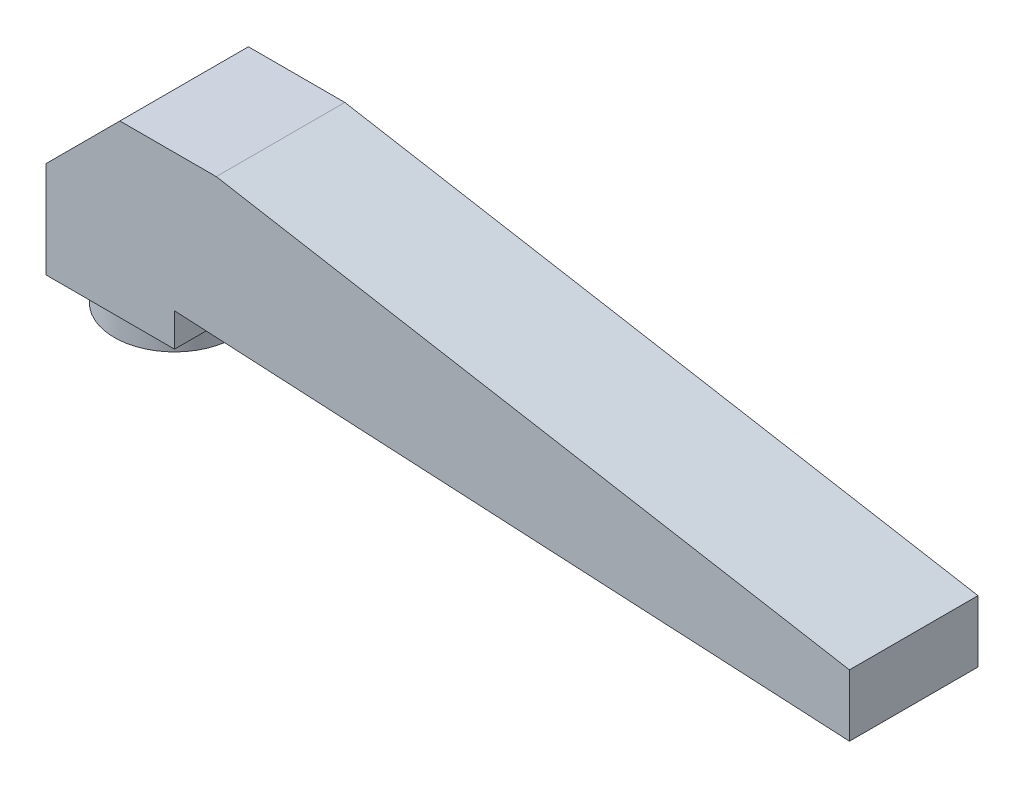
from build123d import *

# Parameters (mm, degrees)
BOSS_EXTRUDE1_DEPTH = 40
SKETCH2_R           = 37.5
BOSS_EXTRUDE2_DEPTH = 15


with BuildPart() as part:
    # Sketch1 → Boss-Extrude1 (new, symmetric)
    with BuildSketch(Plane.XY):
        Polygon((0, 0), (0, 60), (45.961940777, 105.961940777), (105.961940777, 105.961940777), (500, 37.157813838), (500, -1.316470088), (80, 20.694797211), (80, 0), align=None)
    extrude(amount=BOSS_EXTRUDE1_DEPTH, both=True)


with BuildPart() as body_2:
    # Sketch2 → Boss-Extrude2 (new body)
    with BuildSketch(Plane.XZ):
        with Locations(Location((40, 0, 0), (0, 0, 270))):
            Circle(SKETCH2_R)
    extrude(amount=BOSS_EXTRUDE2_DEPTH)


solid = Compound([part.part, body_2.part])
